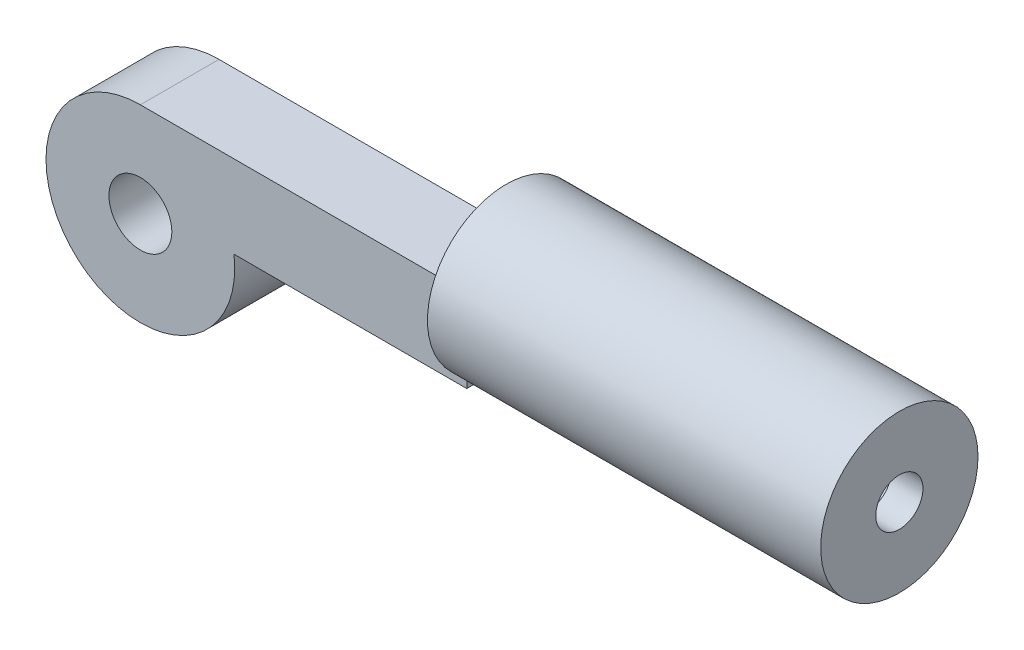
from build123d import *

# Parameters (mm, degrees)
SKETCH1_R                = 120
BOSS_EXTRUDE2_DEPTH      = 100
SKETCH2_R                = 40
CUT_EXTRUDE1_DEPTH       = 100
SKETCH3_R                = 100
BOSS_EXTRUDE3_DEPTH      = 500
BOSS_EXTRUDE4_REACH      = 597.777
BOSS_EXTRUDE4_END_RADIUS = 120
SKETCH4_W                = 100
SKETCH4_H                = 105
SKETCH5_R                = 30
CUT_EXTRUDE2_DEPTH       = 40
SKETCH6_R                = 60
CUT_EXTRUDE3_DEPTH       = 40


with BuildPart() as part:
    # Sketch1 → Boss-Extrude2 (new body)
    with BuildSketch(Plane.XY):
        Circle(SKETCH1_R)
    extrude(amount=BOSS_EXTRUDE2_DEPTH)

    # Sketch2 → Cut-Extrude1 (cut)
    with BuildSketch(Plane.XY.offset(100)):
        Circle(SKETCH2_R)
    extrude(amount=-CUT_EXTRUDE1_DEPTH, mode=Mode.SUBTRACT)



with BuildPart() as body_2:
    # Sketch3 → Boss-Extrude3 (new body)
    with BuildSketch(Plane(origin=(915, 0, 0), x_dir=(0, 0, -1), z_dir=(1, 0, 0))):
        with Locations((-50, 115)):
            Circle(SKETCH3_R)
    extrude(amount=-BOSS_EXTRUDE3_DEPTH)


with BuildPart() as part_1:
    add(part.part)

    add(body_2.part)  # Boss-Extrude4 merges body 2
    # Boss-Extrude4: up to this cylinder (the profile starts outside it)
    boss_extrude4_end = Plane(origin=(0, 0, 50), z_dir=(0, 0, -1)) * Cylinder(BOSS_EXTRUDE4_END_RADIUS, 1436.554, mode=Mode.PRIVATE)
    # Sketch4 → Boss-Extrude4 (add, up to the surface)
    with BuildSketch(Plane.ZY.offset(-415), mode=Mode.PRIVATE) as boss_extrude4_sk1:
        with Locations((50, 67.5)):
            Rectangle(SKETCH4_W, SKETCH4_H)
    boss_extrude4_tool1 = extrude(boss_extrude4_sk1.sketch, amount=BOSS_EXTRUDE4_REACH, mode=Mode.PRIVATE) - boss_extrude4_end
    add(boss_extrude4_tool1.solids().sort_by_distance((415, 67.5, 50))[0])

    # Sketch5 → Cut-Extrude2 (cut)
    with BuildSketch(Plane(origin=(915, 0, 0), x_dir=(0, 0, -1), z_dir=(1, 0, 0))):
        with Locations((-50, 115)):
            Circle(SKETCH5_R)
    extrude(amount=-CUT_EXTRUDE2_DEPTH, mode=Mode.SUBTRACT)

    # Sketch6 → Cut-Extrude3 (cut)
    with BuildSketch(Plane(origin=(875, 0, 0), x_dir=(0, 0, -1), z_dir=(1, 0, 0))):
        with Locations((-50, 115)):
            Circle(SKETCH6_R)
    extrude(amount=-CUT_EXTRUDE3_DEPTH, mode=Mode.SUBTRACT)


solid = part_1.part
